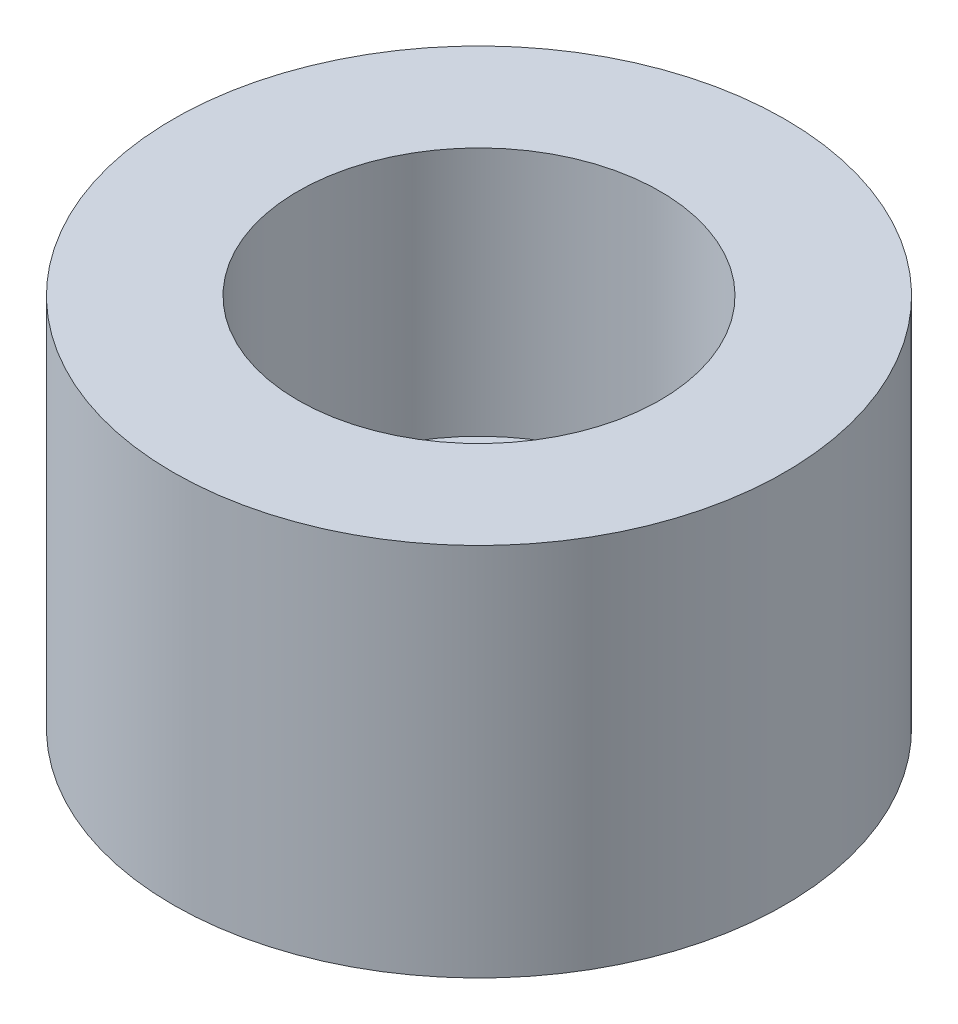
from build123d import *

# Parameters (mm, degrees)
SKETCH1_R           = 4.9
SKETCH1_R_2         = 2.9
BOSS_EXTRUDE1_DEPTH = 4
BOSS_EXTRUDE2_START = -2
SKETCH1_2_R         = 4.9
BOSS_EXTRUDE2_DEPTH = 2


with BuildPart() as part:
    # Sketch1 → Boss-Extrude1 (new body)
    with BuildSketch(Plane(origin=(0, 0, 0), x_dir=(1, 0, 0), z_dir=(0, 1, 0))):
        Circle(SKETCH1_R)
        Circle(SKETCH1_R_2, mode=Mode.SUBTRACT)
    extrude(amount=BOSS_EXTRUDE1_DEPTH)

    # Sketch1<2> → Boss-Extrude2 (add)
    with BuildSketch(Plane(origin=(0, 0, 0), x_dir=(1, 0, 0), z_dir=(0, 1, 0)).offset(BOSS_EXTRUDE2_START)):
        Circle(SKETCH1_2_R)
    extrude(amount=BOSS_EXTRUDE2_DEPTH)


solid = part.part
